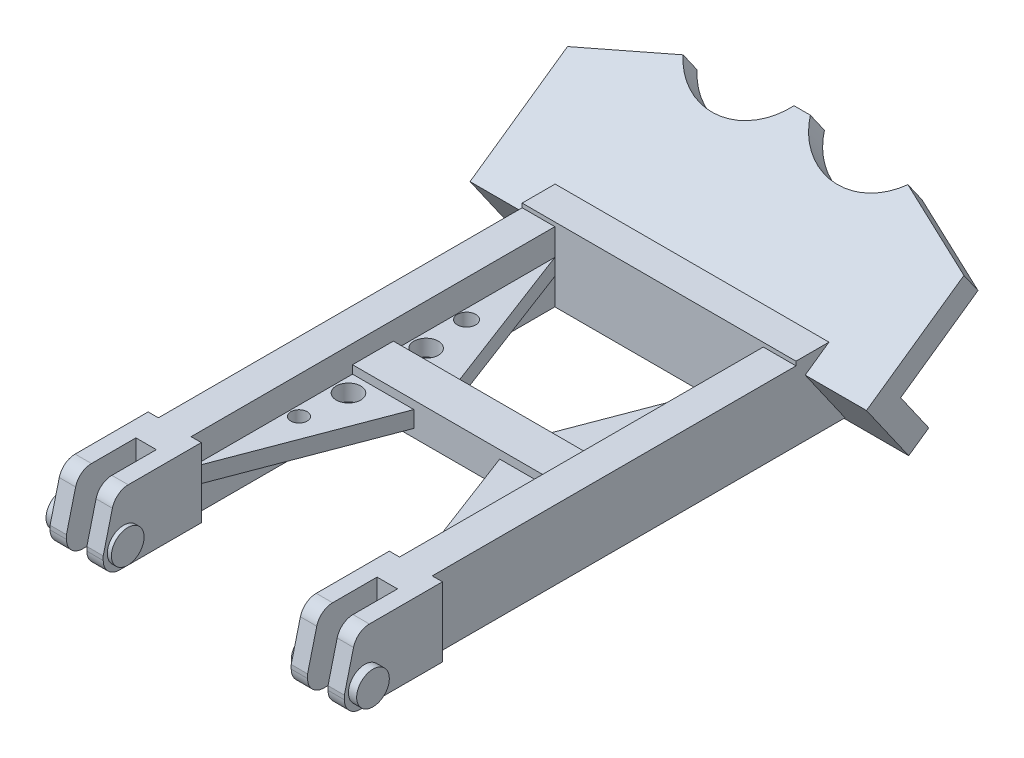
from build123d import *
from OCP.BRepFilletAPI import BRepFilletAPI_MakeChamfer

# Parameters (mm, degrees)
BOSS_EXTRUDE1_DEPTH      = 0.85
SKETCH3_R                = 0.3
SKETCH3_R_2              = 0.2
SKETCH3_R_3              = 0.225
BOSS_EXTRUDE2_DEPTH      = 0.2
FILLET1_R                = 0.4
CHAMFER1_SIZE            = 1.2
CHAMFER1_SIZE2           = 0.3
FILLET2_R                = 0.4
BOSS_EXTRUDE4_DEPTH      = 0.2
BOSS_EXTRUDE4_DEPTH_BACK = 1.4
SKETCH7_R                = 0.4
BOSS_EXTRUDE5_DEPTH      = 0.2
BOSS_EXTRUDE5_DEPTH_BACK = 1.4
SKETCH8_R                = 0.4
SKETCH6_W                = 0.5
SKETCH6_H                = 1.7
CUT_EXTRUDE1_DEPTH       = 11.924284874
BOSS_EXTRUDE8_DEPTH      = 0.2
BOSS_EXTRUDE8_DEPTH_BACK = 0.6
SKETCH11_W               = 5.1
SKETCH11_H               = 1
BOSS_EXTRUDE9_DEPTH      = 4.85
CUT_EXTRUDE2_DEPTH       = 9.7
BOSS_EXTRUDE11_START     = 0.7
SKETCH16_R               = 0.25
SKETCH16_R_2             = 0.2
BOSS_EXTRUDE11_DEPTH     = 0.4
BOSS_EXTRUDE12_START     = 1.1
SKETCH17_R               = 0.2
SKETCH17_R_2             = 0.25
BOSS_EXTRUDE12_DEPTH     = 0.4
CUT_EXTRUDE3_DEPTH       = 0.4
CUT_EXTRUDE3_DEPTH_BACK  = 1
SKETCH18_W               = 6.7
SKETCH18_H               = 1
BOSS_EXTRUDE13_DEPTH     = 0.1
SCALE1_SCALE             = 2


with BuildPart() as part:
    # Sketch1 → Boss-Extrude1 (new, symmetric)
    with BuildSketch(Plane(origin=(0, 0, 0), x_dir=(1, 0, 0), z_dir=(0, 1, 0))):
        Polygon((-3.35, 0), (-3.35, 10.1), (3.35, 10.1), (3.35, 0), (3.6, 0), (3.6, -2.4), (2.3, -2.4), (2.3, 0), (2.55, 0), (2.55, 8.9), (-2.55, 8.9), (-2.55, 0), (-2.3, 0), (-2.3, -2.4), (-3.6, -2.4), (-3.6, 0), align=None)
    extrude(amount=BOSS_EXTRUDE1_DEPTH, both=True)

    # Sketch3 → Boss-Extrude2 (add, symmetric)
    with BuildSketch(Plane(origin=(0, 0, 0), x_dir=(1, 0, 0), z_dir=(0, 1, 0))):
        Polygon((-2.55, 3.95), (-2.55, 0), (-1.05, 3.95), (1.05, 3.95), (2.55, 0), (2.55, 3.95), (2.55, 4.95), (2.55, 8.9), (1.05, 4.95), (-1.05, 4.95), (-2.55, 8.9), (-2.55, 4.95), align=None)
        with Locations((-2.2, 3.5)):
            Circle(SKETCH3_R, mode=Mode.SUBTRACT)
        with Locations((2.2, 3.5)):
            Circle(SKETCH3_R, mode=Mode.SUBTRACT)
        with Locations((-2.31, 2.4)):
            Circle(SKETCH3_R_2, mode=Mode.SUBTRACT)
        with Locations((-2.31, 6.5)):
            Circle(SKETCH3_R_3, mode=Mode.SUBTRACT)
        with Locations((2.2, 5.4)):
            Circle(SKETCH3_R, mode=Mode.SUBTRACT)
        with Locations((-2.2, 5.4)):
            Circle(SKETCH3_R, mode=Mode.SUBTRACT)
        with Locations((2.31, 2.4)):
            Circle(SKETCH3_R_2, mode=Mode.SUBTRACT)
        with Locations((2.31, 6.5)):
            Circle(SKETCH3_R_3, mode=Mode.SUBTRACT)
    extrude(amount=BOSS_EXTRUDE2_DEPTH, both=True)

    # Fillet1
    fillet1_edges = [part.edges().sort_by_distance(p)[0] for p in [
        (2.95, -0.85, 2.4),
        (-2.95, -0.85, 2.4),
    ]]
    fillet(fillet1_edges, radius=FILLET1_R)

    # Chamfer1: one chamfer whose edges measure the first distance from different faces: ONE call of the kernel's chamfer builder (chamfer() names one face for all edges)
    chamfer1_edges_1 = [part.edges().sort_by_distance(p)[0] for p in [
        (2.95, 0.85, 2.4),
    ]]
    chamfer1_side_1 = [part.faces().sort_by_distance(p)[0] for p in [
        (2.95, 0.2, 2.4),
    ]]
    chamfer1_edges_2 = [part.edges().sort_by_distance(p)[0] for p in [
        (-2.95, 0.85, 2.4),
    ]]
    chamfer1_side_2 = [part.faces().sort_by_distance(p)[0] for p in [
        (-2.95, 0.2, 2.4),
    ]]
    chamfer1 = BRepFilletAPI_MakeChamfer(part.part.solid().wrapped)
    for e in chamfer1_edges_1:
        chamfer1.Add(CHAMFER1_SIZE, CHAMFER1_SIZE2, e.wrapped, chamfer1_side_1[0].wrapped)  # the first distance lies on this face
    for e in chamfer1_edges_2:
        chamfer1.Add(CHAMFER1_SIZE, CHAMFER1_SIZE2, e.wrapped, chamfer1_side_2[0].wrapped)  # the first distance lies on this face
    add(Compound.cast(chamfer1.Shape()), mode=Mode.REPLACE)

    # Fillet2
    fillet2_edges = [part.edges().sort_by_distance(p)[0] for p in [
        (2.95, 0.85, 2.1),
        (-2.95, 0.85, 2.1),
    ]]
    fillet(fillet2_edges, radius=FILLET2_R)

    # Sketch7 → Boss-Extrude4 (add, two sides: drawn at the far end of the back side and taken through both)
    with BuildSketch(Plane.ZY.offset(3.6).offset(-BOSS_EXTRUDE4_DEPTH_BACK)):
        with Locations((1.9, -0.35)):
            Circle(SKETCH7_R)
    extrude(amount=BOSS_EXTRUDE4_DEPTH + BOSS_EXTRUDE4_DEPTH_BACK)

    # Sketch8 → Boss-Extrude5 (add, two sides: drawn at the far end of the back side and taken through both)
    with BuildSketch(Plane(origin=(3.6, 0, 0), x_dir=(0, 0, -1), z_dir=(1, 0, 0)).offset(-BOSS_EXTRUDE5_DEPTH_BACK)):
        with Locations((-1.9, -0.35)):
            Circle(SKETCH8_R)
    extrude(amount=BOSS_EXTRUDE5_DEPTH + BOSS_EXTRUDE5_DEPTH_BACK)

    # Sketch6 → Cut-Extrude1 (cut, through all)
    with BuildSketch(Plane(origin=(0, 0.85, 0), x_dir=(1, 0, 0), z_dir=(0, 1, 0))):
        with Locations((-2.95, -1.55)):
            Rectangle(SKETCH6_W, SKETCH6_H)
        with Locations((2.95, -1.55)):
            Rectangle(SKETCH6_W, SKETCH6_H)
    extrude(amount=-CUT_EXTRUDE1_DEPTH, mode=Mode.SUBTRACT)

    # Sketch11 → Boss-Extrude8 (add, two sides: drawn at the far end of the back side and taken through both)
    with BuildSketch(Plane(origin=(0, 0.2, 0), x_dir=(1, 0, 0), z_dir=(0, 1, 0)).offset(-BOSS_EXTRUDE8_DEPTH_BACK)):
        with Locations((0, 4.45)):
            Rectangle(SKETCH11_W, SKETCH11_H)
    extrude(amount=BOSS_EXTRUDE8_DEPTH + BOSS_EXTRUDE8_DEPTH_BACK)

    # Sketch12 → Boss-Extrude9 (add, symmetric)
    with BuildSketch(Plane(origin=(0, 0, 0), x_dir=(0, 0, -1), z_dir=(1, 0, 0))):
        Polygon((9.124920058, 0.542558475), (10.157357644, -0.931915204), (10.64884887, -0.587769343), (9.960557147, 0.395213111), (12.745674097, 2.345372994), (12.401528235, 2.836864221), align=None)
    extrude(amount=BOSS_EXTRUDE9_DEPTH, both=True)

    # Sketch13 → Cut-Extrude2 (cut)
    with BuildSketch(Plane(origin=(3.35, 0, 0), x_dir=(0, 0, -1), z_dir=(1, 0, 0))):
        Polygon((9.960557147, 0.395213111), (10.1, 0.196068077), (10.1, 0.492852048), align=None)
    extrude(amount=-CUT_EXTRUDE2_DEPTH, mode=Mode.SUBTRACT)

    # Sketch16 → Boss-Extrude11 (add)
    with BuildSketch(Plane.ZY.offset(BOSS_EXTRUDE11_START)):
        Polygon((-9.960557147, 0.395213111), (-12.172267666, 1.943869489), (-10.64884887, -0.587769343), align=None)
        with Locations((-10.322666552, 0.331363452)):
            Circle(SKETCH16_R, mode=Mode.SUBTRACT)
        with Locations((-10.949309365, 0.831182204)):
            Circle(SKETCH16_R_2, mode=Mode.SUBTRACT)
    extrude(amount=BOSS_EXTRUDE11_DEPTH)

    # Sketch17 → Boss-Extrude12 (add)
    with BuildSketch(Plane(origin=(0, 0, 0), x_dir=(0, 0, -1), z_dir=(1, 0, 0)).offset(BOSS_EXTRUDE12_START)):
        Polygon((12.172267666, 1.943869489), (9.960557147, 0.395213111), (10.64884887, -0.587769343), align=None)
        with Locations((10.949309365, 0.831182204)):
            Circle(SKETCH17_R, mode=Mode.SUBTRACT)
        with Locations((10.322666552, 0.331363452)):
            Circle(SKETCH17_R_2, mode=Mode.SUBTRACT)
    extrude(amount=-BOSS_EXTRUDE12_DEPTH)

    # Sketch14 → Cut-Extrude3 (cut, two sides: drawn at the far end of the back side and taken through both)
    with BuildSketch(Plane(origin=(0, -4.414739047, -3.09123356), x_dir=(-1, 0, 0), z_dir=(0, -0.8191520442889928, -0.5735764363510448)).offset(-CUT_EXTRUDE3_DEPTH_BACK)):
        with BuildLine():
            Line((-4.85, 10.696327944), (-2.75, 11.585895676))
            ThreePointArc((-2.75, 11.585895676), (-1.419001054, 10.971909117), (-0.2, 11.785895676))
            Line((-0.2, 11.785895676), (0.2, 11.785895676))
            ThreePointArc((0.2, 11.785895676), (1.419001054, 10.971909117), (2.75, 11.585895676))
            Line((2.75, 11.585895676), (4.85, 10.696327944))
            Line((4.85, 10.696327944), (4.85, 12.785895676))
            Line((4.85, 12.785895676), (-4.85, 12.785895676))
            Line((-4.85, 12.785895676), (-4.85, 10.696327944))
        make_face()
    extrude(amount=CUT_EXTRUDE3_DEPTH + CUT_EXTRUDE3_DEPTH_BACK, mode=Mode.SUBTRACT)

    # Sketch18 → Boss-Extrude13 (add)
    with BuildSketch(Plane(origin=(0, 0.85, 0), x_dir=(1, 0, 0), z_dir=(0, 1, 0))):
        with Locations((0, 9.4)):
            Rectangle(SKETCH18_W, SKETCH18_H)
    extrude(amount=BOSS_EXTRUDE13_DEPTH)


with BuildPart() as part_1:
    # Scale1: scaled about (0, 0, 0)
    add(part.part.scale(SCALE1_SCALE))


solid = part_1.part
